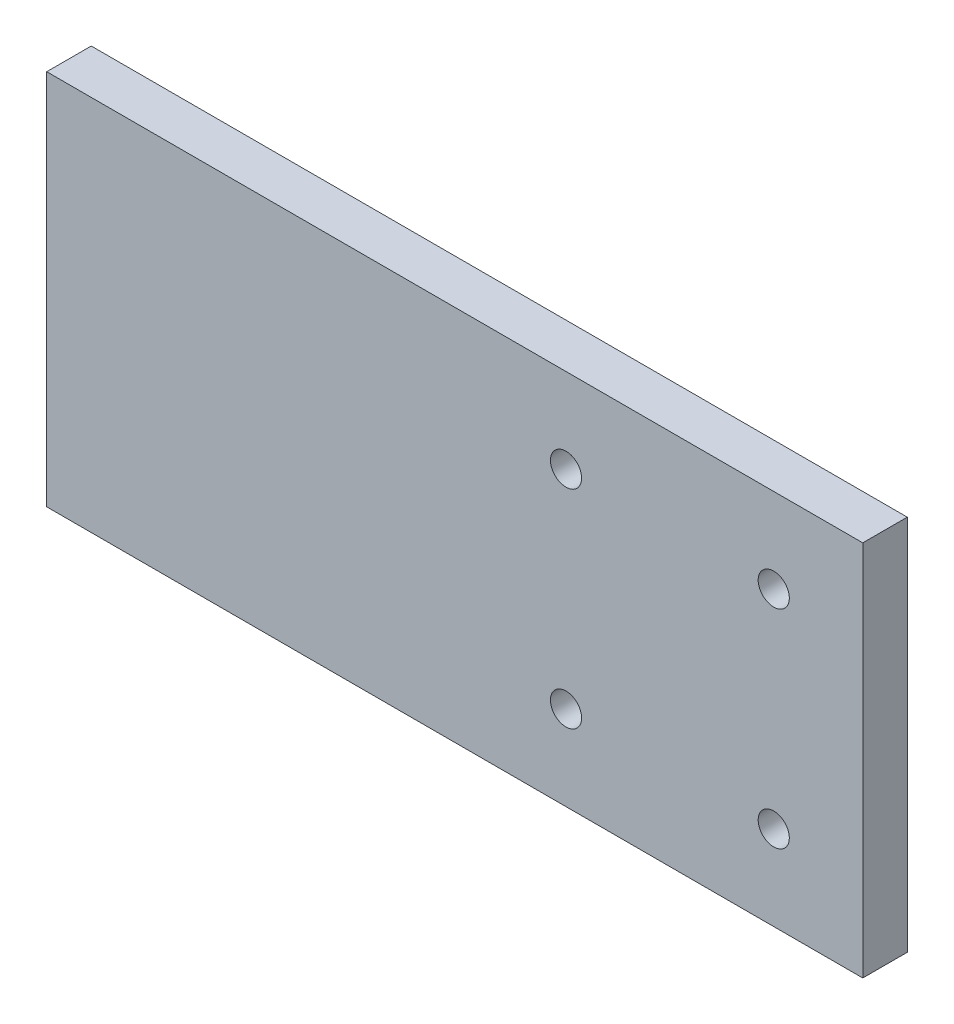
from build123d import *

# Parameters (mm, degrees)
SKETCH1_W           = 110
SKETCH1_H           = 50.8
SKETCH1_R           = 2.1
BOSS_EXTRUDE1_DEPTH = 6


with BuildPart() as part:
    # Sketch1 → Boss-Extrude1 (new body)
    with BuildSketch(Plane.XY):
        with Locations((55, 25.4)):
            Rectangle(SKETCH1_W, SKETCH1_H)
        with Locations((98, 39.4)):
            Circle(SKETCH1_R, mode=Mode.SUBTRACT)
        with Locations((98, 11.4)):
            Circle(SKETCH1_R, mode=Mode.SUBTRACT)
        with Locations((70, 39.4)):
            Circle(SKETCH1_R, mode=Mode.SUBTRACT)
        with Locations((70, 11.4)):
            Circle(SKETCH1_R, mode=Mode.SUBTRACT)
    extrude(amount=BOSS_EXTRUDE1_DEPTH)


solid = part.part
